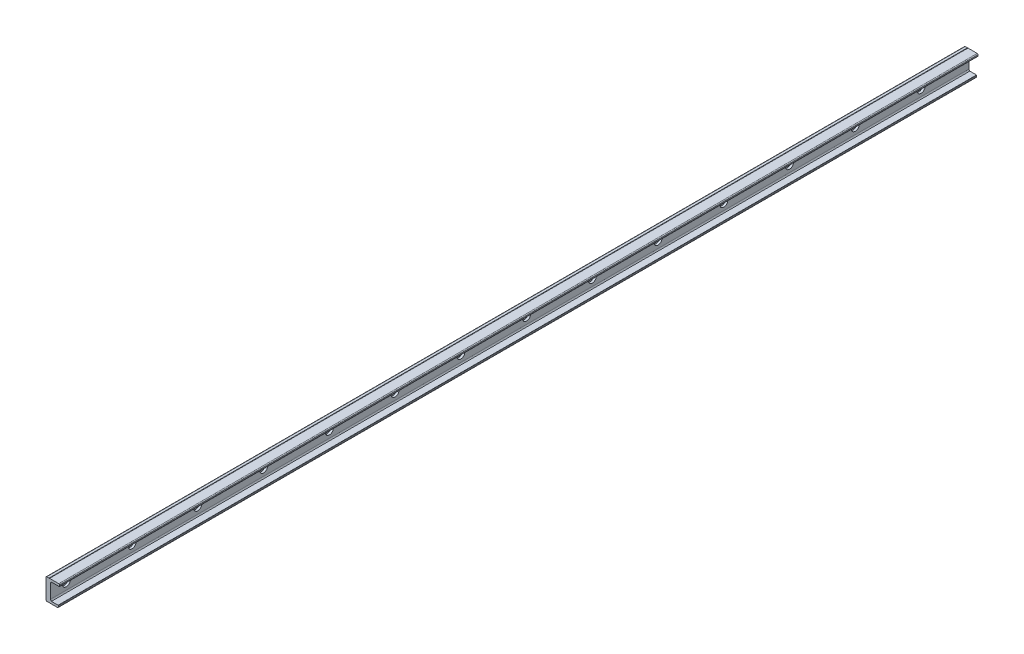
from build123d import *

# Parameters (mm, degrees)
BOSS_EXTRUDE1_DEPTH = 1219.2
SKETCH2_R           = 4.8895
CUT_EXTRUDE1_DEPTH  = 2.794
SKETCH3_R           = 2.8956
CUT_EXTRUDE2_DEPTH  = 1220.345961888
LPATTERN1_COUNT     = 31
LPATTERN1_PITCH     = 80
CUT_EXTRUDE3_START  = -1320.8
CUT_EXTRUDE3_DEPTH  = 1320.8


with BuildPart() as part:
    # Sketch1 → Boss-Extrude1 (new, symmetric)
    with BuildSketch(Plane.XY):
        with BuildLine():
            Line((15.494, 12.954), (4.394, 12.954))
            ThreePointArc((4.394, 12.954), (4.064, 12.624), (3.734, 12.954))
            Line((3.734, 12.954), (1.016, 12.954))
            ThreePointArc((1.016, 12.954), (0.29757951, 12.65642049), (0, 11.938))
            Line((0, 11.938), (0, -11.938))
            ThreePointArc((0, -11.938), (0.29757951, -12.65642049), (1.016, -12.954))
            Line((1.016, -12.954), (13.97, -12.954))
            ThreePointArc((13.97, -12.954), (14.68842049, -12.65642049), (14.986, -11.938))
            Line((14.986, -11.938), (14.986, -10.832020833))
            ThreePointArc((14.986, -10.832020833), (14.920380976, -10.472810588), (14.732, -10.16))
            Line((14.732, -10.16), (6.604, -10.16))
            ThreePointArc((6.604, -10.16), (5.86023638, -9.41623638), (5.588, -8.40023638))
            Line((5.588, -8.40023638), (5.588, 8.40023638))
            ThreePointArc((5.588, 8.40023638), (5.86023638, 9.41623638), (6.604, 10.16))
            Line((6.604, 10.16), (14.732, 10.16))
            ThreePointArc((14.732, 10.16), (15.853210245, 9.881639857), (16.51, 10.832020833))
            Line((16.51, 10.832020833), (16.51, 11.938))
            ThreePointArc((16.51, 11.938), (16.21242049, 12.65642049), (15.494, 12.954))
        make_face()
    extrude(amount=BOSS_EXTRUDE1_DEPTH, both=True)

    # Sketch2 → Cut-Extrude1 (cut)
    with BuildSketch(Plane(origin=(5.588, 0, 0), x_dir=(0, 0, -1), z_dir=(1, 0, 0))):
        with Locations(Location((-1200, 0, 0), (0, 0, 90))):
            Circle(SKETCH2_R)
    cut_extrude1 = extrude(amount=-CUT_EXTRUDE1_DEPTH, mode=Mode.SUBTRACT)

    # Sketch3 → Cut-Extrude2 (cut, through all)
    with BuildSketch(Plane(origin=(2.794, 0, 0), x_dir=(0, 0, -1), z_dir=(1, 0, 0))):
        with Locations(Location((-1200, 0, 0), (0, 0, 90))):
            Circle(SKETCH3_R)
    cut_extrude2 = extrude(amount=-CUT_EXTRUDE2_DEPTH, mode=Mode.SUBTRACT)

    # LPattern1: Cut-Extrude1, Cut-Extrude2 ×31
    with Locations(*[(0, 0, -i * LPATTERN1_PITCH) for i in range(1, LPATTERN1_COUNT)]):
        add(cut_extrude1, mode=Mode.SUBTRACT)
        add(cut_extrude2, mode=Mode.SUBTRACT)

    # Sketch5 → Cut-Extrude3 (cut)
    with BuildSketch(Plane(origin=(0, 0, -1219.2), x_dir=(-1, 0, 0), z_dir=(0, 0, -1)).offset(CUT_EXTRUDE3_START)):
        with BuildLine():
            Line((-16.51, 11.938), (-16.51, 10.832020833))
            ThreePointArc((-16.51, 10.832020833), (-15.853210245, 9.881639857), (-14.732, 10.16))
            Line((-14.732, 10.16), (-6.604, 10.16))
            ThreePointArc((-6.604, 10.16), (-5.86023638, 9.41623638), (-5.588, 8.40023638))
            Line((-5.588, 8.40023638), (-5.588, -8.40023638))
            ThreePointArc((-5.588, -8.40023638), (-5.86023638, -9.41623638), (-6.604, -10.16))
            Line((-6.604, -10.16), (-14.732, -10.16))
            ThreePointArc((-14.732, -10.16), (-14.920380976, -10.472810588), (-14.986, -10.832020833))
            Line((-14.986, -10.832020833), (-14.986, -11.938))
            ThreePointArc((-14.986, -11.938), (-14.68842049, -12.65642049), (-13.97, -12.954))
            Line((-13.97, -12.954), (-1.016, -12.954))
            ThreePointArc((-1.016, -12.954), (-0.29757951, -12.65642049), (0, -11.938))
            Line((0, -11.938), (0, 11.938))
            ThreePointArc((0, 11.938), (-0.29757951, 12.65642049), (-1.016, 12.954))
            Line((-1.016, 12.954), (-3.734, 12.954))
            ThreePointArc((-3.734, 12.954), (-4.064, 12.624), (-4.394, 12.954))
            Line((-4.394, 12.954), (-15.494, 12.954))
            ThreePointArc((-15.494, 12.954), (-16.21242049, 12.65642049), (-16.51, 11.938))
        make_face()
    extrude(amount=CUT_EXTRUDE3_DEPTH, mode=Mode.SUBTRACT)


solid = part.part
